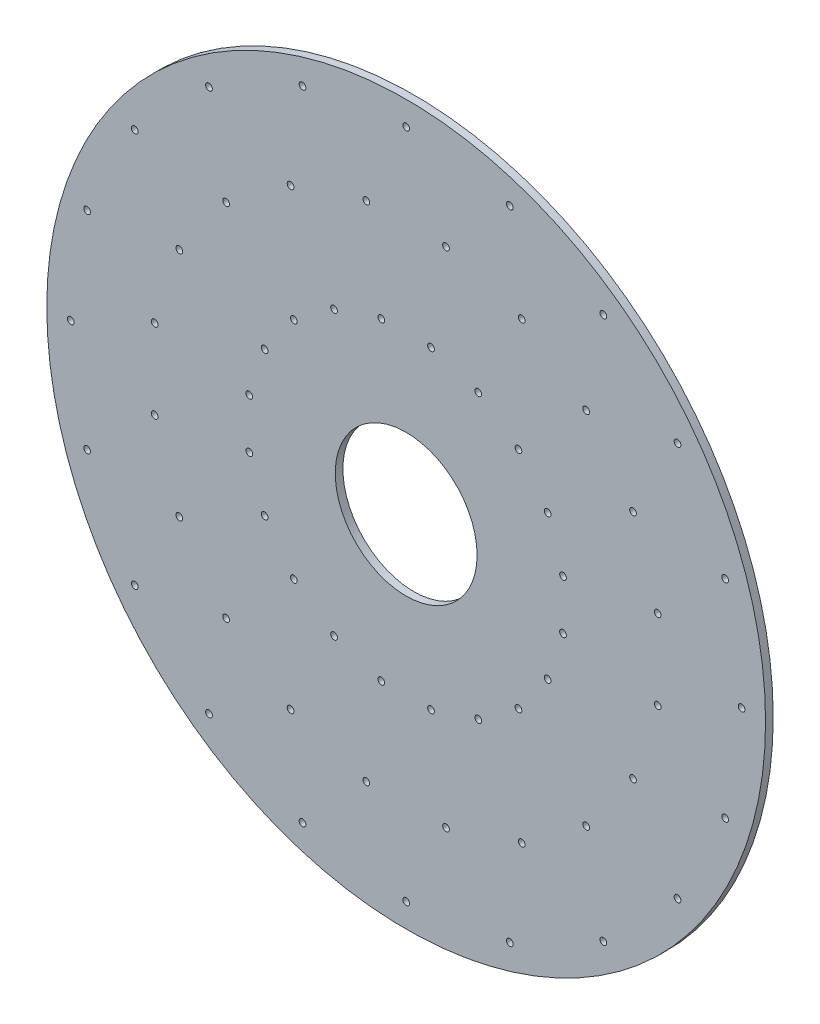
from build123d import *

# Parameters (mm, degrees)
SKETCH1_R           = 187.5
BOSS_EXTRUDE1_DEPTH = 4
SKETCH2_R           = 37
CUT_EXTRUDE1_DEPTH  = 266.195211118
SKETCH3_R           = 1.755
CUT_EXTRUDE2_DEPTH  = 266.195211118
CIRPATTERN1_COUNT   = 20
SKETCH4_R           = 1.755
CUT_EXTRUDE3_DEPTH  = 266.195211118
CIRPATTERN2_COUNT   = 20


with BuildPart() as part:
    # Sketch1 → Boss-Extrude1 (new body)
    with BuildSketch(Plane.XY):
        Circle(SKETCH1_R)
    extrude(amount=BOSS_EXTRUDE1_DEPTH)

    # Sketch2 → Cut-Extrude1 (cut, through all)
    with BuildSketch(Plane.XY.offset(4)):
        Circle(SKETCH2_R)
    extrude(amount=-CUT_EXTRUDE1_DEPTH, mode=Mode.SUBTRACT)

    # Sketch3 → Cut-Extrude2 (cut, through all)
    with BuildSketch(Plane.XY.offset(4)):
        with Locations((0, 175)):
            Circle(SKETCH3_R)
    cut_extrude2 = extrude(amount=-CUT_EXTRUDE2_DEPTH, mode=Mode.SUBTRACT)

    # CirPattern1: Cut-Extrude2 ×20 about axis
    cirpattern1_axis = Axis((0, 0, -0.2), (0, 0, 1))
    for i in range(1, CIRPATTERN1_COUNT):
        add(cut_extrude2.rotate(cirpattern1_axis, i * 360 / CIRPATTERN1_COUNT), mode=Mode.SUBTRACT)

    # Sketch4 → Cut-Extrude3 (cut, through all)
    with BuildSketch(Plane(origin=(0, 0, 0), x_dir=(-1, 0, 0), z_dir=(0, 0, -1))):
        with Locations((-12.959885154, -81.825494522)):
            Circle(SKETCH4_R)
        with Locations((-20.781608406, -131.209911552)):
            Circle(SKETCH4_R)
    cut_extrude3 = extrude(amount=-CUT_EXTRUDE3_DEPTH, mode=Mode.SUBTRACT)

    # CirPattern2: Cut-Extrude3 ×20 about axis
    cirpattern2_axis = Axis((0, 0, -0.2), (0, 0, 1))
    for i in range(1, CIRPATTERN2_COUNT):
        add(cut_extrude3.rotate(cirpattern2_axis, i * 360 / CIRPATTERN2_COUNT), mode=Mode.SUBTRACT)


solid = part.part
